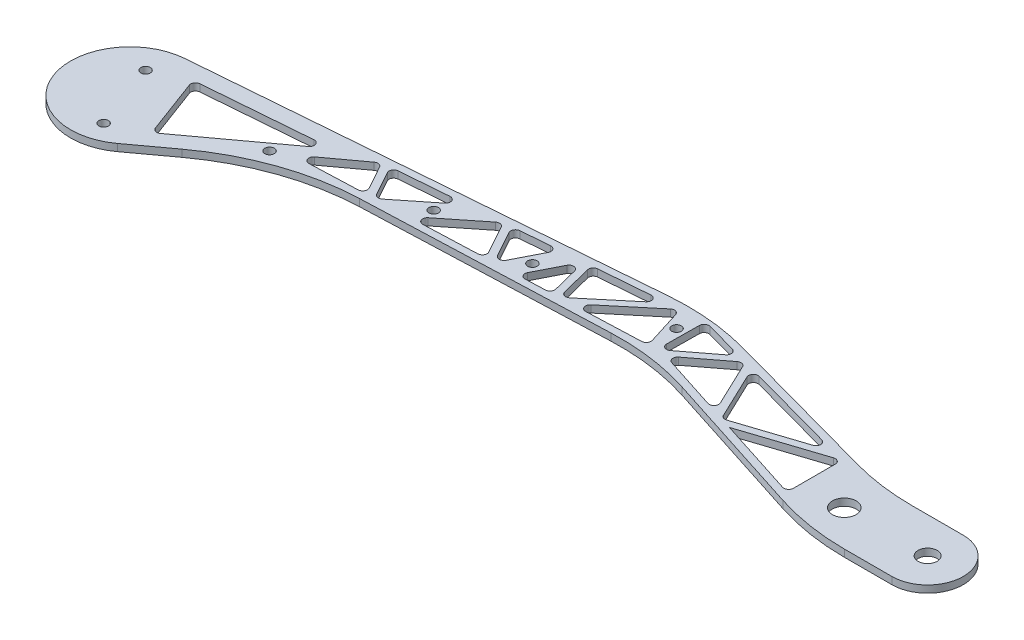
from build123d import *

# Parameters (mm, degrees)
SKETCH1_R           = 5
SKETCH1_R_2         = 4
BOSS_EXTRUDE1_DEPTH = 3
FILLET1_R           = 100
SKETCH2_R           = 2
CUT_EXTRUDE1_DEPTH  = 3
FILLET2_R           = 2


with BuildPart() as part:
    # Sketch1 → Boss-Extrude1 (new body)
    with BuildSketch(Plane(origin=(0, 0, 0), x_dir=(1, 0, 0), z_dir=(0, 1, 0))):
        with BuildLine():
            Line((0, 15), (-96.417851723, 41.525419301))
            Line((-96.417851723, 41.525419301), (-302.012777379, 24.918842815))
            ThreePointArc((-302.012777379, 24.918842815), (-323.422288966, -8.74050225), (-285.196078396, -20.145567878))
            Line((-285.196078396, -20.145567878), (-244.853395733, 9.500154448))
            Line((-244.853395733, 9.500154448), (-94.853395733, 15.263592787))
            Line((-94.853395733, 15.263592787), (-8.209432186, -12.55409189))
            Line((-8.209432186, -12.55409189), (0, -15))
            Line((0, -15), (35, -15))
            ThreePointArc((35, -15), (50, 0), (35, 15))
            Line((35, 15), (0, 15))
        make_face()
        with Locations(Location((0, 0, 0), (0, 0, 270))):
            Circle(SKETCH1_R, mode=Mode.SUBTRACT)
        with Locations(Location((35, 0, 0), (0, 0, 270))):
            Circle(SKETCH1_R_2, mode=Mode.SUBTRACT)
    extrude(amount=BOSS_EXTRUDE1_DEPTH)

    # Fillet1
    fillet1_edges = [part.edges().sort_by_distance(p)[0] for p in [
        (0, 1.5, -15),
        (-96.417851723, 1.5, -41.525419301),
        (-94.853395733, 1.5, -15.263592787),
        (-244.853395733, 1.5, -9.500154448),
        (0, 1.5, 15),
    ]]
    fillet(fillet1_edges, radius=FILLET1_R)

    # Sketch2 → Cut-Extrude1 (cut)
    with BuildSketch(Plane(origin=(0, 3, 0), x_dir=(1, 0, 0), z_dir=(0, 1, 0))):
        with Locations(Location((-100.410325029, 29.966674425, 0), (0, 0, 270))):
            Circle(SKETCH2_R)
        with Locations(Location((-154.331360865, 23.327852047, 0), (0, 0, 270))):
            Circle(SKETCH2_R)
        with Locations(Location((-194.43609766, 21.998076888, 0), (0, 0, 270))):
            Circle(SKETCH2_R)
        with Locations(Location((-250.479012244, 9.089087069, 0), (0, 0, 270))):
            Circle(SKETCH2_R)
        with Locations(Location((-305.880435037, 12.401187858, 0), (0, 0, 270))):
            Circle(SKETCH2_R)
        with Locations(Location((-295.391832737, -15.705559051, 0), (0, 0, 270))):
            Circle(SKETCH2_R)
        Polygon((-292.21586201, 18.687373798), (-281.876511166, -9.019417731), (-238.23936591, 23.047232428), align=None)
        Polygon((-17.754718765, 16.773026019), (-17.754718765, -6.33868172), (-53.365436428, 5.0944023), align=None)
        Polygon((-22.990022437, 18.213305206), (-69.89582428, 31.117513703), (-58.230092835, 6.656236183), align=None)
        Polygon((-62.154702225, 7.916261025), (-73.721446188, 32.169976742), (-92.622909187, 17.698303988), align=None)
        Polygon((-77.35185331, 33.168734435), (-96.92030532, 18.186389746), (-96.703582242, 38.492569336), align=None)
        Polygon((-244.106325436, 12.531072737), (-222.617491874, 28.322089864), (-214.487999018, 13.66909539), align=None)
        Polygon((-106.555479442, 37.696799286), (-100.410325029, 18.05229299), (-131.520316701, 16.856956198), align=None)
        Polygon((-111.738383291, 37.278159142), (-136.427588937, 16.668404458), (-141.03422906, 34.911837591), align=None)
        Polygon((-144.066545636, 34.666907435), (-139.492021115, 16.550660019), (-153.569970314, 16.009744071), align=None)
        Polygon((-153.429835368, 33.910603812), (-162.727242525, 15.657894913), (-172.020743917, 32.408955151), align=None)
        Polygon((-175.304372068, 32.143725735), (-166.086412512, 15.528825786), (-197.65154914, 14.316000995), align=None)
        Polygon((-219.333863723, 28.58731928), (-211.128829032, 13.798164517), (-189.577714365, 30.990821062), align=None)
    extrude(amount=-CUT_EXTRUDE1_DEPTH, mode=Mode.SUBTRACT)

    # Fillet2
    fillet2_edges = [part.edges().sort_by_distance(p)[0] for p in [
        (-96.92030532, 1.5, -18.186389746),
        (-96.703582242, 1.5, -38.492569336),
        (-77.35185331, 1.5, -33.168734435),
        (-17.754718765, 1.5, -16.773026019),
        (-17.754718765, 1.5, 6.33868172),
        (-22.990022437, 1.5, -18.213305206),
        (-58.230092835, 1.5, -6.656236183),
        (-69.89582428, 1.5, -31.117513703),
        (-62.154702225, 1.5, -7.916261025),
        (-92.622909187, 1.5, -17.698303988),
        (-73.721446188, 1.5, -32.169976742),
        (-214.487999018, 1.5, -13.66909539),
        (-244.106325436, 1.5, -12.531072737),
        (-222.617491874, 1.5, -28.322089864),
        (-219.333863723, 1.5, -28.58731928),
        (-189.577714365, 1.5, -30.990821062),
        (-211.128829032, 1.5, -13.798164517),
        (-172.020743917, 1.5, -32.408955151),
        (-153.429835368, 1.5, -33.910603812),
        (-162.727242525, 1.5, -15.657894913),
        (-141.03422906, 1.5, -34.911837591),
        (-111.738383291, 1.5, -37.278159142),
        (-136.427588937, 1.5, -16.668404458),
        (-131.520316701, 1.5, -16.856956198),
        (-106.555479442, 1.5, -37.696799286),
        (-100.410325029, 1.5, -18.05229299),
        (-153.569970314, 1.5, -16.009744071),
        (-144.066545636, 1.5, -34.666907435),
        (-139.492021115, 1.5, -16.550660019),
        (-197.65154914, 1.5, -14.316000995),
        (-175.304372068, 1.5, -32.143725735),
        (-166.086412512, 1.5, -15.528825786),
        (-292.21586201, 1.5, -18.687373798),
        (-238.23936591, 1.5, -23.047232428),
        (-281.876511166, 1.5, 9.019417731),
    ]]
    fillet(fillet2_edges, radius=FILLET2_R)


solid = part.part
